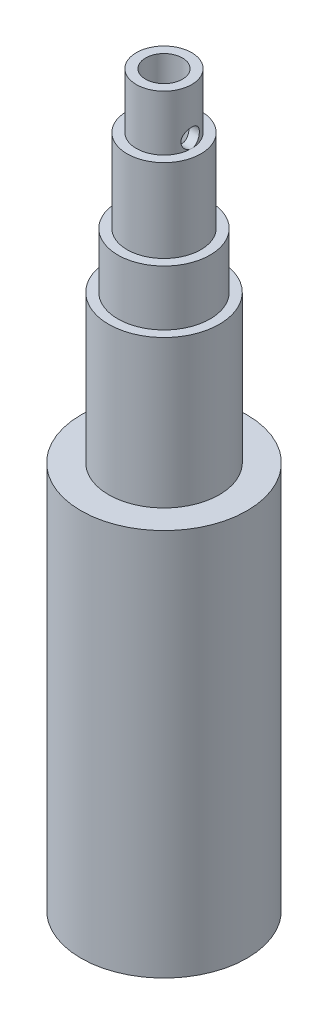
from build123d import *

# Parameters (mm, degrees)
SKETCH1_R                      = 9
BASE_SECTION_DEPTH             = 42
SKETCH2_R                      = 6
SECOND_SECTION_DEPTH           = 16
SKETCH3_R                      = 5
BEARING_SECTION_DEPTH          = 6
SKETCH4_R                      = 4
SEAL_SECTION_DEPTH             = 9
SKETCH5_R                      = 3
IMPELLER_SECTION_DEPTH         = 6
SKETCH6_R                      = 2
IMPELLER_SCREW_HOLE_DEPTH      = 10
SKETCH7_R                      = 4
MOTOR_SHAFT_HOLE_DEPTH         = 32
IMPELLER_DOWEL_HOLE_DEPTH      = 10
IMPELLER_DOWEL_HOLE_DEPTH_BACK = 10
SKETCH8_R                      = 1
SKETCH9_R                      = 3
SET_SCREW_HOLES_DEPTH          = 20


with BuildPart() as part:
    # Sketch1 → base section (new body)
    with BuildSketch(Plane(origin=(0, 0, 0), x_dir=(1, 0, 0), z_dir=(0, 1, 0))):
        Circle(SKETCH1_R)
    extrude(amount=BASE_SECTION_DEPTH)

    # Sketch2 → second section (add)
    with BuildSketch(Plane(origin=(0, 42, 0), x_dir=(1, 0, 0), z_dir=(0, 1, 0))):
        Circle(SKETCH2_R)
    extrude(amount=SECOND_SECTION_DEPTH)

    # Sketch3 → bearing section (add)
    with BuildSketch(Plane(origin=(0, 58, 0), x_dir=(1, 0, 0), z_dir=(0, 1, 0))):
        Circle(SKETCH3_R)
    extrude(amount=BEARING_SECTION_DEPTH)

    # Sketch4 → seal section (add)
    with BuildSketch(Plane(origin=(0, 64, 0), x_dir=(1, 0, 0), z_dir=(0, 1, 0))):
        Circle(SKETCH4_R)
    extrude(amount=SEAL_SECTION_DEPTH)

    # Sketch5 → impeller section (add)
    with BuildSketch(Plane(origin=(0, 73, 0), x_dir=(1, 0, 0), z_dir=(0, 1, 0))):
        Circle(SKETCH5_R)
    extrude(amount=IMPELLER_SECTION_DEPTH)

    # Sketch6 → impeller screw hole (cut)
    with BuildSketch(Plane(origin=(0, 79, 0), x_dir=(1, 0, 0), z_dir=(0, 1, 0))):
        Circle(SKETCH6_R)
    extrude(amount=-IMPELLER_SCREW_HOLE_DEPTH, mode=Mode.SUBTRACT)

    # Sketch7 → motor shaft hole (cut)
    with BuildSketch(Plane(origin=(0, 0, 0), x_dir=(-1, 0, 0), z_dir=(0, -1, 0))):
        Circle(SKETCH7_R)
    extrude(amount=-MOTOR_SHAFT_HOLE_DEPTH, mode=Mode.SUBTRACT)

    # Sketch8 → impeller dowel hole (cut, two sides: drawn at the far end of the back side and taken through both)
    with BuildSketch(Plane(origin=(0, 0, 0), x_dir=(0, 0, -1), z_dir=(1, 0, 0)).offset(-IMPELLER_DOWEL_HOLE_DEPTH_BACK)):
        with Locations((0, 74)):
            Circle(SKETCH8_R)
    extrude(amount=IMPELLER_DOWEL_HOLE_DEPTH + IMPELLER_DOWEL_HOLE_DEPTH_BACK, mode=Mode.SUBTRACT)

    # Sketch9 → set screw holes (cut)
    with BuildSketch(Plane(origin=(0, 0, 0), x_dir=(0, 0, -1), z_dir=(1, 0, 0))):
        with Locations((0, 29)):
            Circle(SKETCH9_R)
        with Locations((0, 18.333333333)):
            Circle(SKETCH9_R)
    extrude(amount=-SET_SCREW_HOLES_DEPTH, mode=Mode.SUBTRACT)


solid = part.part
